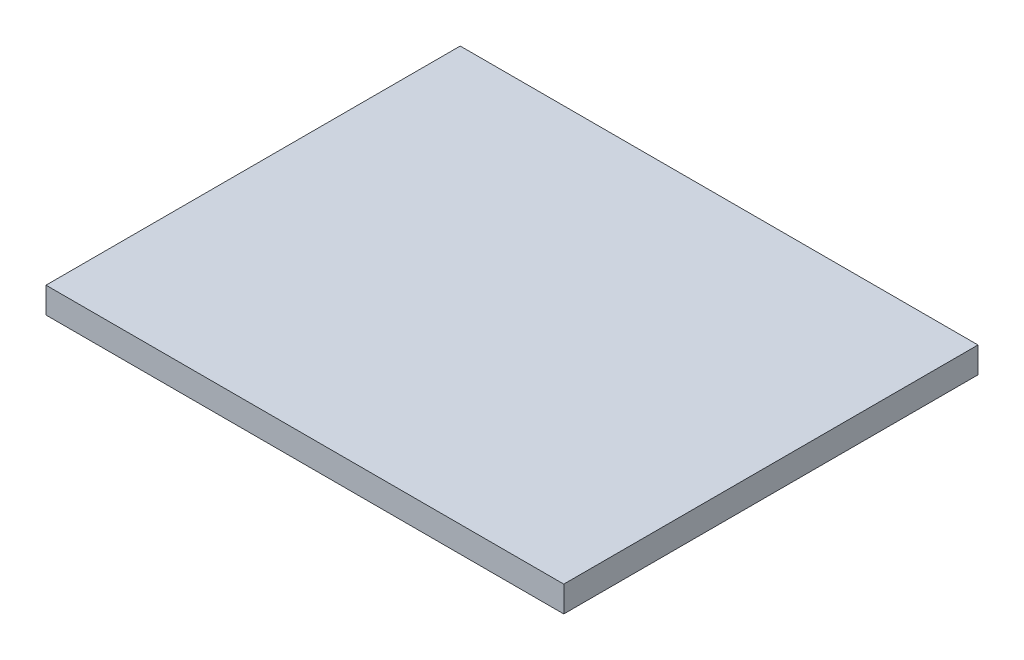
from build123d import *

# Parameters (mm, degrees)
SKETCH1_W           = 100
SKETCH1_H           = 80
BOSS_EXTRUDE1_DEPTH = 5


with BuildPart() as part:
    # Sketch1 → Boss-Extrude1 (new body)
    with BuildSketch(Plane(origin=(0, 0, 0), x_dir=(1, 0, 0), z_dir=(0, 1, 0))):
        with Locations((50, 40)):
            Rectangle(SKETCH1_W, SKETCH1_H)
    extrude(amount=BOSS_EXTRUDE1_DEPTH)


solid = part.part
